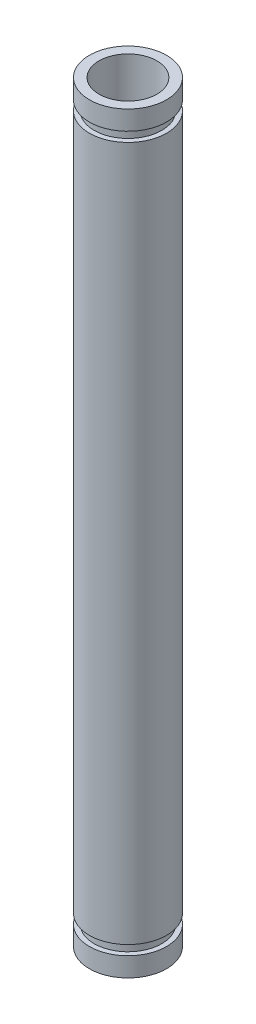
from build123d import *


with BuildPart() as part:
    # Sketch1 → Revolve1 (revolve)
    with BuildSketch(Plane.XY, mode=Mode.PRIVATE) as revolve1_sk:
        Polygon((-3, 39), (-4, 39), (-4, 37), (-3.5, 37), (-3.5, 36), (-4, 36), (-4, -36), (-3.5, -36), (-3.5, -37), (-4, -37), (-4, -39), (-3, -39), align=None)
    revolve(revolve1_sk.sketch.rotate(Axis((0, 43.952944243, 0), (0, -1, 0)), 270), axis=Axis((0, 43.952944243, 0), (0, -1, 0)))


solid = part.part
